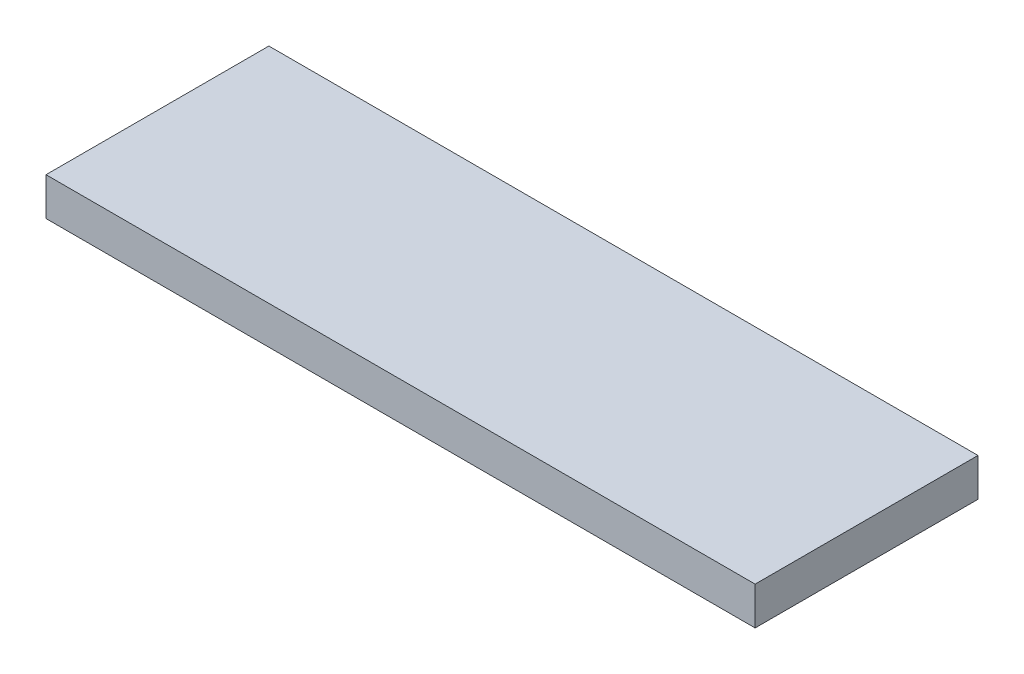
from build123d import *

# Parameters (mm, degrees)
SKETCH1_W           = 177.8
SKETCH1_H           = 55.88
BOSS_EXTRUDE1_DEPTH = 9.525


with BuildPart() as part:
    # Sketch1 → Boss-Extrude1 (new body)
    with BuildSketch(Plane(origin=(0, 0, 0), x_dir=(1, 0, 0), z_dir=(0, 1, 0))):
        with Locations((-88.9, 27.94)):
            Rectangle(SKETCH1_W, SKETCH1_H)
    extrude(amount=BOSS_EXTRUDE1_DEPTH)


solid = part.part
